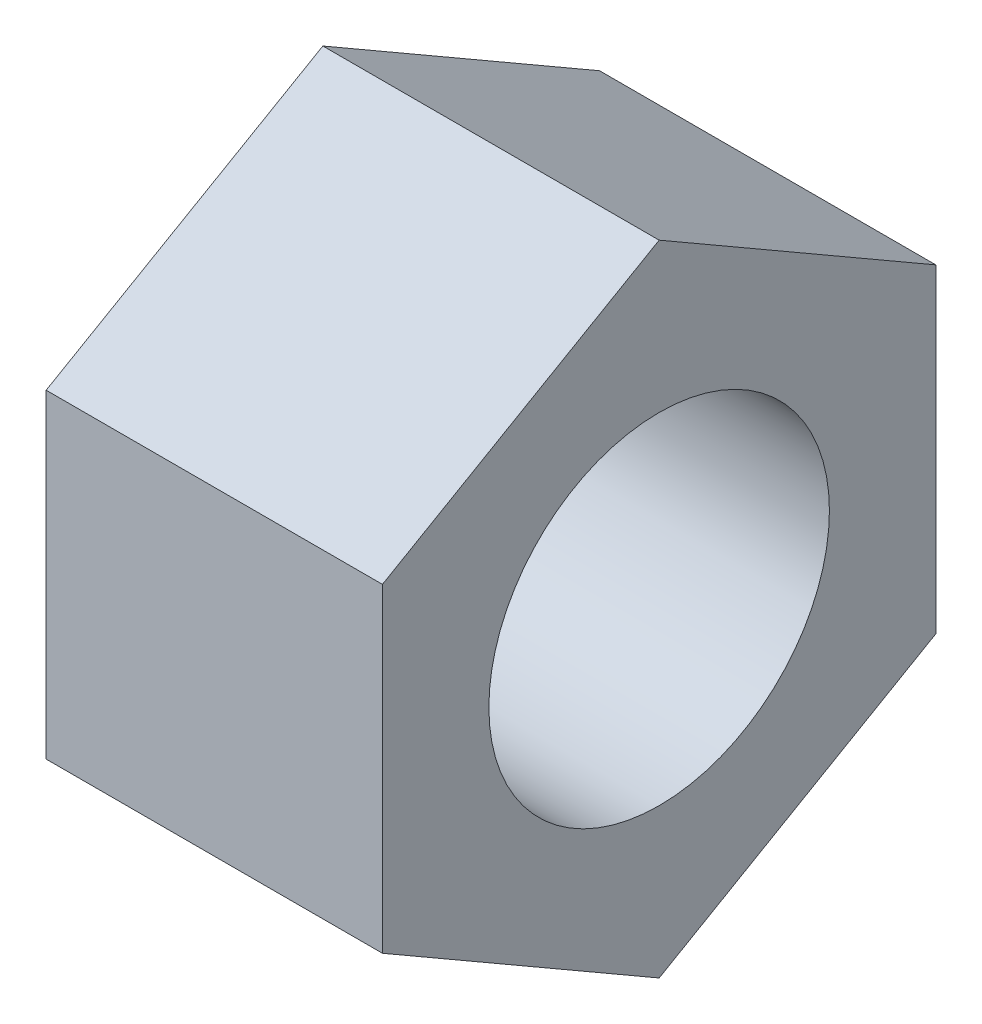
from build123d import *

# Parameters (mm, degrees)
SKETCH2_R           = 4
BOSS_EXTRUDE1_DEPTH = 7.9


with BuildPart() as part:
    # Sketch2 → Boss-Extrude1 (new body)
    with BuildSketch(Plane.YZ):
        Polygon((7.505553499, 0), (3.75277675, 6.5), (-3.75277675, 6.5), (-7.505553499, 0), (-3.75277675, -6.5), (3.75277675, -6.5), align=None)
        with Locations(Location((0, 0, 0), (0, 0, 270))):
            Circle(SKETCH2_R, mode=Mode.SUBTRACT)
    extrude(amount=BOSS_EXTRUDE1_DEPTH)


solid = part.part
